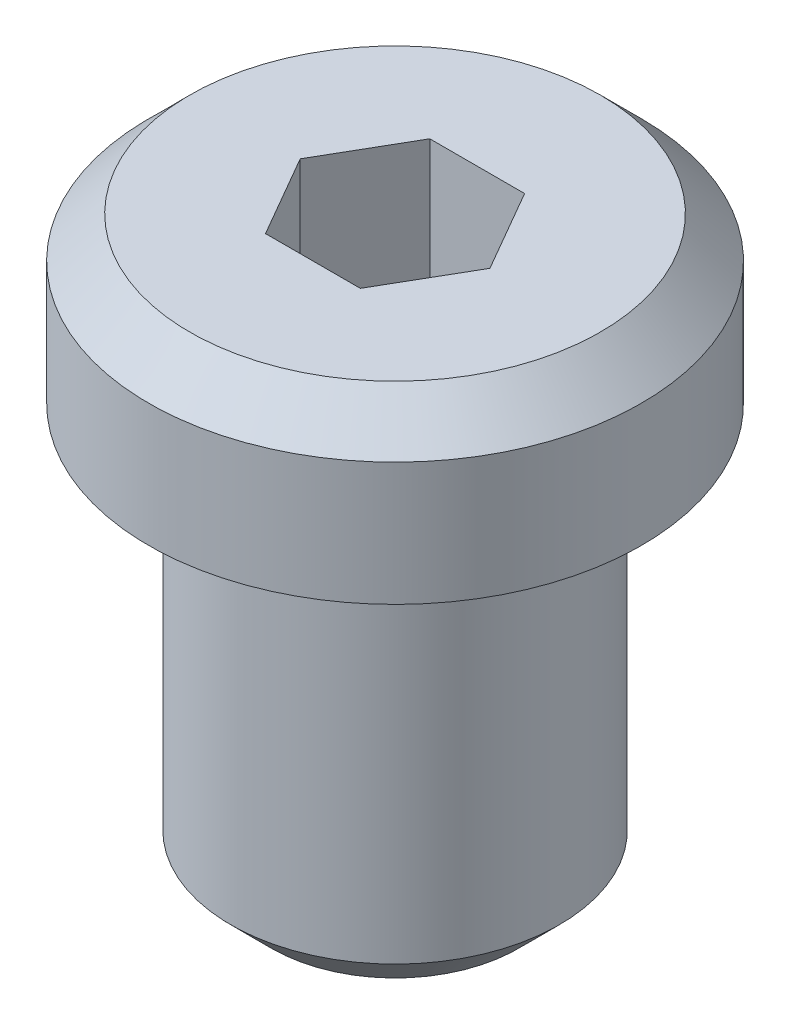
from build123d import *

# Parameters (mm, degrees)
CORTAR_EXTRUIR1_DEPTH = 4


with BuildPart() as part:
    # Croquis2 → Revolución1 (revolve)
    with BuildSketch(Plane.XY, mode=Mode.PRIVATE) as revoluci_n1_sk:
        Polygon((0, 0), (0, 14), (5, 14), (6, 13), (6, 10), (4, 10), (4, 1), (3, 0), align=None)
    revolve(revoluci_n1_sk.sketch.rotate(Axis((0, 0, 0), (0, 1, 0)), 90), axis=Axis((0, 0, 0), (0, 1, 0)))

    # Croquis3 → Cortar-Extruir1 (cut)
    with BuildSketch(Plane(origin=(0, 14, 0), x_dir=(1, 0, 0), z_dir=(0, 1, 0))):
        Polygon((1.154700538, 2), (-1.154700538, 2), (-2.309401077, 0), (-1.154700538, -2), (1.154700538, -2), (2.309401077, 0), align=None)
    extrude(amount=-CORTAR_EXTRUIR1_DEPTH, mode=Mode.SUBTRACT)


solid = part.part
